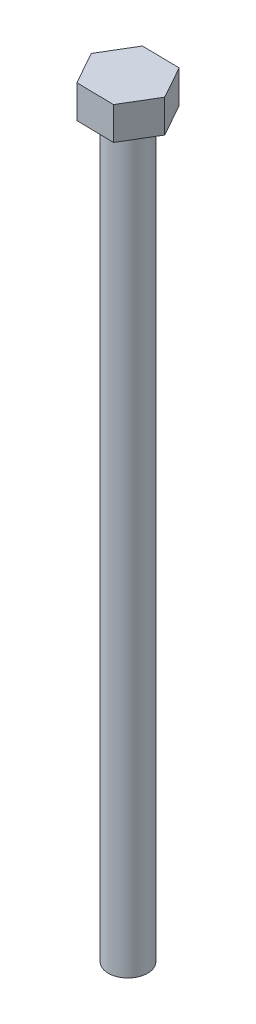
from build123d import *

# Parameters (mm, degrees)
SKETCH1_R           = 3
BOSS_EXTRUDE1_DEPTH = 112
BOSS_EXTRUDE2_DEPTH = 5


with BuildPart() as part:
    # Sketch1 → Boss-Extrude1 (new body)
    with BuildSketch(Plane(origin=(0, 0, 0), x_dir=(1, 0, 0), z_dir=(0, 1, 0))):
        with Locations(Location((0, 0, 0), (0, 0, 270))):
            Circle(SKETCH1_R)
    extrude(amount=BOSS_EXTRUDE1_DEPTH)

    # Sketch2 → Boss-Extrude2 (add)
    with BuildSketch(Plane(origin=(0, 112, 0), x_dir=(1, 0, 0), z_dir=(0, 1, 0))):
        Polygon((2.917683067, 4.876206544), (-2.764077207, 4.964890928), (-5.681760275, 0.088684385), (-2.917683067, -4.876206544), (2.764077207, -4.964890928), (5.681760275, -0.088684385), align=None)
    extrude(amount=BOSS_EXTRUDE2_DEPTH)


solid = part.part
